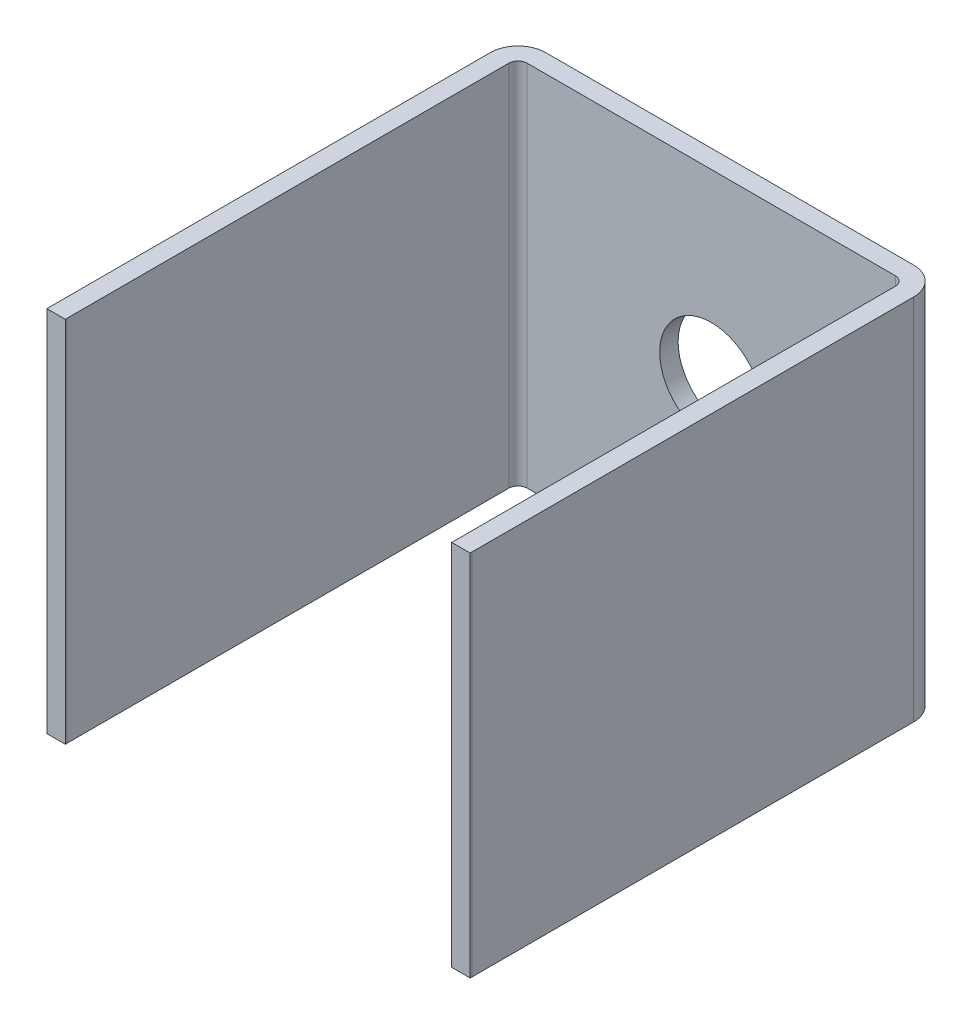
from build123d import *

# Parameters (mm, degrees)
EXTRUDE_THIN1_DEPTH = 50
SKETCH3_R           = 14
CUT_EXTRUDE2_DEPTH  = 10
CUT_EXTRUDE3_REACH  = 135.651
SKETCH4_W           = 129.958556301
SKETCH4_H           = 19.187259519


with BuildPart() as part:
    # Sketch1 → Extrude-Thin1 (new, symmetric)
    with BuildSketch(Plane(origin=(0, 0, 0), x_dir=(1, 0, 0), z_dir=(0, 1, 0))):
        with BuildLine():
            Line((-57.5, 60), (-57.5, -60))
            ThreePointArc((-57.5, -60), (-55.303300859, -65.303300859), (-50, -67.5))
            Line((-50, -67.5), (50, -67.5))
            ThreePointArc((50, -67.5), (55.303300859, -65.303300859), (57.5, -60))
            Line((57.5, -60), (57.5, 60))
            ThreePointArc((57.5, 60), (55.303300859, 65.303300859), (50, 67.5))
            Line((50, 67.5), (-50, 67.5))
            ThreePointArc((-50, 67.5), (-55.303300859, 65.303300859), (-57.5, 60))
        make_face()
        with BuildLine():
            Line((-52.5, 60), (-52.5, -60))
            ThreePointArc((-52.5, -60), (-51.767766953, -61.767766953), (-50, -62.5))
            Line((-50, -62.5), (50, -62.5))
            ThreePointArc((50, -62.5), (51.767766953, -61.767766953), (52.5, -60))
            Line((52.5, -60), (52.5, 60))
            ThreePointArc((52.5, 60), (51.767766953, 61.767766953), (50, 62.5))
            Line((50, 62.5), (-50, 62.5))
            ThreePointArc((-50, 62.5), (-51.767766953, 61.767766953), (-52.5, 60))
        make_face(mode=Mode.SUBTRACT)
    extrude(amount=EXTRUDE_THIN1_DEPTH, both=True)

    # Sketch3 → Cut-Extrude2 (cut)
    with BuildSketch(Plane(origin=(0, 0, -67.5), x_dir=(-1, 0, 0), z_dir=(0, 0, -1))):
        Circle(SKETCH3_R)
    extrude(amount=-CUT_EXTRUDE2_DEPTH, mode=Mode.SUBTRACT)

    # Sketch4 → Cut-Extrude3 (cut, up to next)
    with BuildSketch(Plane(origin=(0, 50, 0), x_dir=(1, 0, 0), z_dir=(0, 1, 0)), mode=Mode.PRIVATE) as cut_extrude3_sk1:
        with Locations((-6.555772869, -70.09362976)):
            Rectangle(SKETCH4_W, SKETCH4_H)
    cut_extrude3_tool1 = extrude(cut_extrude3_sk1.sketch, amount=-CUT_EXTRUDE3_REACH, mode=Mode.PRIVATE) & part.part
    add(cut_extrude3_tool1.solids().sort_by_distance((-6.555773, 50, 70.09363))[0], mode=Mode.SUBTRACT)


solid = part.part
